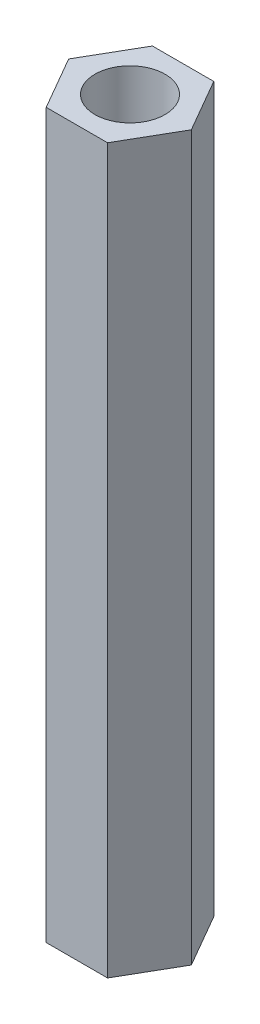
from build123d import *

# Parameters (mm, degrees)
SKETCH_1_R      = 1.55
EXTRUDE_1_DEPTH = 32


with BuildPart() as part:
    # 草图1 → 凸台-拉伸1 (new body)
    with BuildSketch(Plane(origin=(0, 0, 0), x_dir=(1, 0, 0), z_dir=(0, 1, 0))):
        Polygon((2.713546265, 0), (1.356773133, 2.35), (-1.356773133, 2.35), (-2.713546265, 0), (-1.356773133, -2.35), (1.356773133, -2.35), align=None)
        with Locations(Location((0, 0, 0), (0, 0, 270))):
            Circle(SKETCH_1_R, mode=Mode.SUBTRACT)
    extrude(amount=EXTRUDE_1_DEPTH)


solid = part.part
